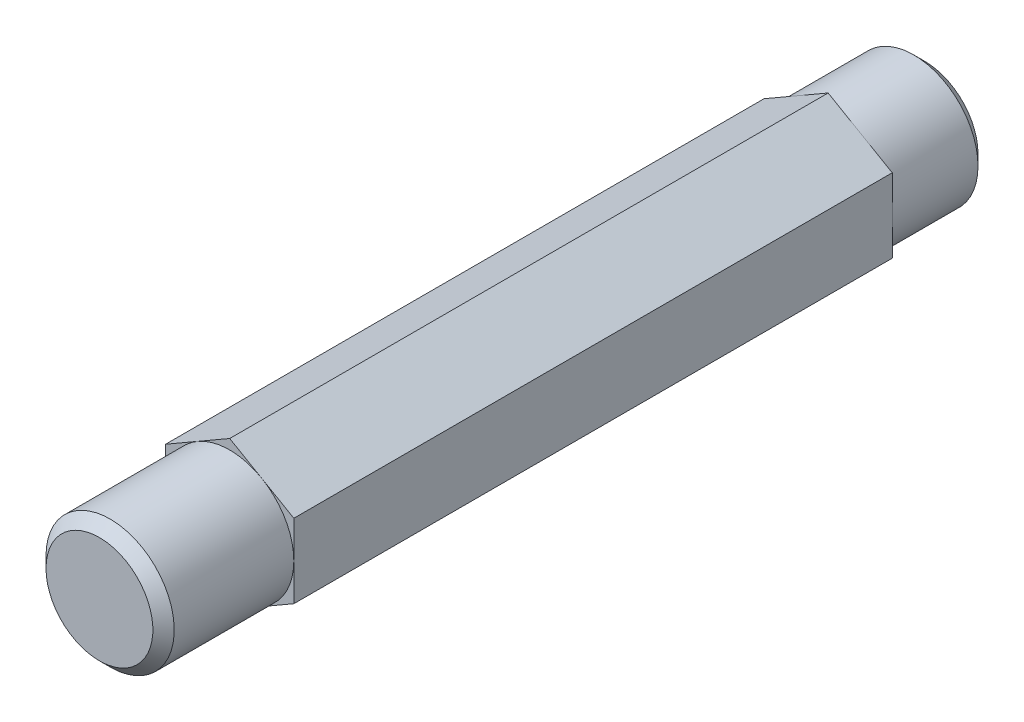
from build123d import *

# Parameters (mm, degrees)
SKETCH1_R           = 4.7625
BOSS_EXTRUDE1_DEPTH = 7.1628
BOSS_EXTRUDE2_DEPTH = 44.45
BOSS_EXTRUDE3_START = 9.6774
SKETCH3_R           = 4.7625
BOSS_EXTRUDE3_DEPTH = 9.6774
CHAMFER1_SIZE       = 0.79375


with BuildPart() as part:
    # Sketch1 → Boss-Extrude1 (new body)
    with BuildSketch(Plane.XY):
        with Locations((8.861538462, 6.041958042)):
            Circle(SKETCH1_R)
    extrude(amount=-BOSS_EXTRUDE1_DEPTH)

    # Sketch2 → Boss-Extrude2 (add)
    with BuildSketch(Plane.XY):
        Polygon((13.624038462, 8.791588699), (8.861538462, 11.541219356), (4.099038462, 8.791588699), (4.099038462, 3.292327385), (8.861538462, 0.542696728), (13.624038462, 3.292327385), align=None)
    extrude(amount=BOSS_EXTRUDE2_DEPTH)

    # Sketch3 → Boss-Extrude3 (add)
    with BuildSketch(Plane.XY.offset(44.45).offset(BOSS_EXTRUDE3_START)):
        with Locations((8.861538462, 6.041958042)):
            Circle(SKETCH3_R)
    extrude(amount=-BOSS_EXTRUDE3_DEPTH)

    # Chamfer1
    chamfer1_edges = [part.edges().sort_by_distance(p)[0] for p in [
        (4.099038462, 6.041958042, 54.1274),
        (4.099038462, 6.041958042, -7.1628),
    ]]
    chamfer(chamfer1_edges, length=CHAMFER1_SIZE)


solid = part.part
